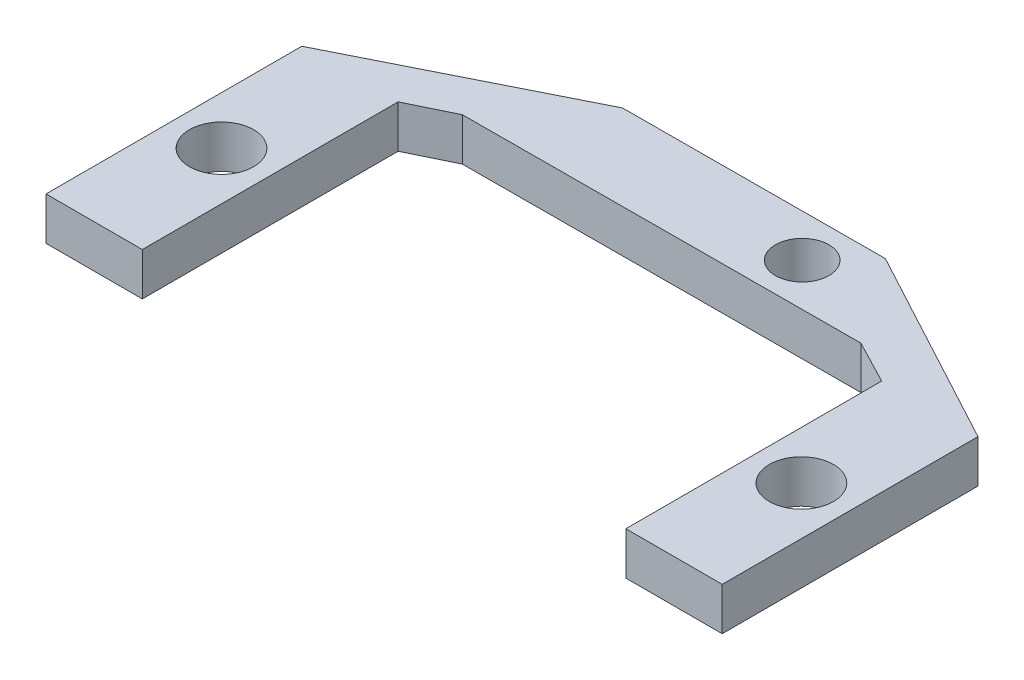
from build123d import *

# Parameters (mm, degrees)
SKETCH1_R           = 1.5
SKETCH1_R_2         = 1.25
BOSS_EXTRUDE1_DEPTH = 2


with BuildPart() as part:
    # Sketch1 → Boss-Extrude1 (new body)
    with BuildSketch(Plane(origin=(0, 0, 0), x_dir=(1, 0, 0), z_dir=(0, 1, 0))):
        Polygon((-21.067974578, -3.1615), (-16.567974578, -3.1615), (-16.567974578, 8.7885), (-14.547974578, 9.7685), (4.002025422, 9.8385), (6.022025422, 8.7885), (6.022025422, -3.1615), (10.522025422, -3.1615), (10.522025422, 8.7885), (1.156070136, 13.827789026), (-11.083929864, 13.781600347), (-21.067974578, 8.7885), align=None)
        with Locations(Location((-18.817974578, 2.7885, 0), (0, 0, 270))):
            Circle(SKETCH1_R, mode=Mode.SUBTRACT)
        with Locations(Location((8.272025422, 2.7885, 0), (0, 0, 270))):
            Circle(SKETCH1_R, mode=Mode.SUBTRACT)
        with Locations(Location((-0.723929864, 11.820680446, 0), (0, 0, 270))):
            Circle(SKETCH1_R_2, mode=Mode.SUBTRACT)
    extrude(amount=BOSS_EXTRUDE1_DEPTH)


solid = part.part
